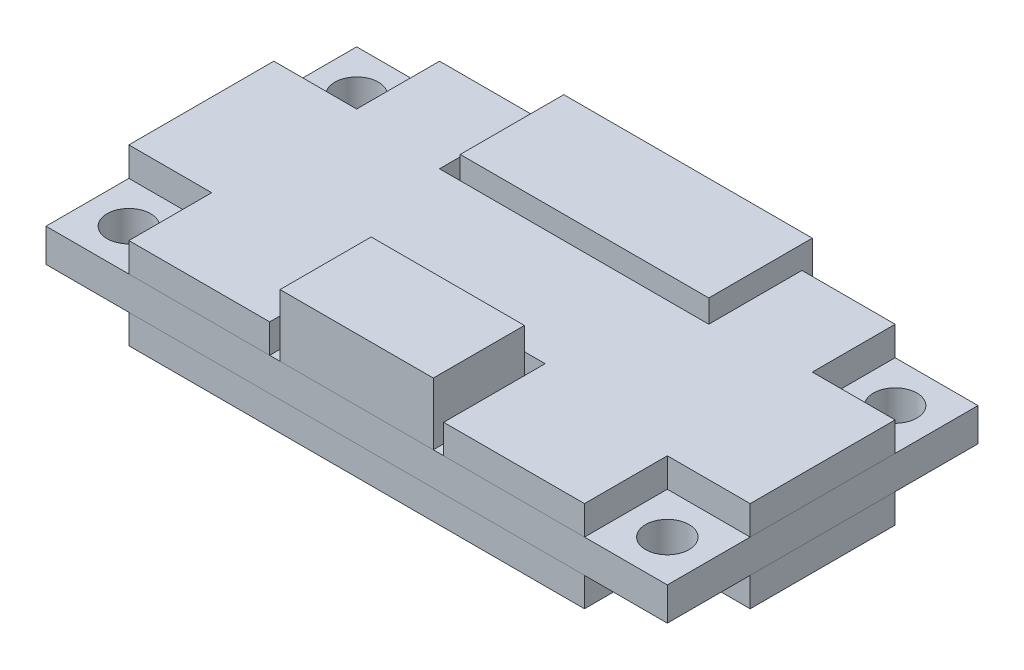
from build123d import *

# Parameters (mm, degrees)
SKETCH1_W           = 30
SKETCH1_H           = 15
SKETCH1_R           = 1.05
BOSS_EXTRUDE1_DEPTH = 1.6
SKETCH2_W           = 12
SKETCH2_H           = 5
BOSS_EXTRUDE2_DEPTH = 2
SKETCH3_W           = 7.4
SKETCH3_H           = 4.4
BOSS_EXTRUDE3_DEPTH = 3
BOSS_EXTRUDE4_DEPTH = 1.4
BOSS_EXTRUDE5_DEPTH = 1.4


with BuildPart() as part:
    # Sketch1 → Boss-Extrude1 (new body)
    with BuildSketch(Plane(origin=(0, 0, 0), x_dir=(1, 0, 0), z_dir=(0, 1, 0))):
        Rectangle(SKETCH1_W, SKETCH1_H)
        with Locations(Location((13, 5.5, 0), (0, 0, 270))):
            Circle(SKETCH1_R, mode=Mode.SUBTRACT)
        with Locations(Location((13, -5.5, 0), (0, 0, 270))):
            Circle(SKETCH1_R, mode=Mode.SUBTRACT)
        with Locations(Location((-13, -5.5, 0), (0, 0, 270))):
            Circle(SKETCH1_R, mode=Mode.SUBTRACT)
        with Locations(Location((-13, 5.5, 0), (0, 0, 270))):
            Circle(SKETCH1_R, mode=Mode.SUBTRACT)
    extrude(amount=-BOSS_EXTRUDE1_DEPTH)


with BuildPart() as body_2:
    # Sketch2 → Boss-Extrude2 (new body)
    with BuildSketch(Plane(origin=(0, 0, 0), x_dir=(1, 0, 0), z_dir=(0, 1, 0))):
        with Locations((0, 6)):
            Rectangle(SKETCH2_W, SKETCH2_H)
    extrude(amount=BOSS_EXTRUDE2_DEPTH)


with BuildPart() as body_3:
    # Sketch3 → Boss-Extrude3 (new body)
    with BuildSketch(Plane(origin=(0, 0, 0), x_dir=(1, 0, 0), z_dir=(0, 1, 0))):
        with Locations((0, -5.3)):
            Rectangle(SKETCH3_W, SKETCH3_H)
    extrude(amount=BOSS_EXTRUDE3_DEPTH)


with BuildPart() as body_4:
    # Sketch4 → Boss-Extrude4 (new body)
    with BuildSketch(Plane.XZ.offset(1.6)):
        Polygon((-15, 3.5), (-11, 3.5), (-11, 7.5), (11, 7.5), (11, 3.5), (15, 3.5), (15, -3.5), (11, -3.5), (11, -7.5), (-11, -7.5), (-11, -3.5), (-15, -3.5), align=None)
    extrude(amount=BOSS_EXTRUDE4_DEPTH)


with BuildPart() as body_5:
    # Sketch5 → Boss-Extrude5 (new body)
    with BuildSketch(Plane(origin=(0, 0, 0), x_dir=(1, 0, 0), z_dir=(0, 1, 0))):
        Polygon((-11, -3.5), (-11, -7.5), (-4.2, -7.5), (-4.2, -2.6), (4.2, -2.6), (4.2, -7.5), (11, -7.5), (11, -3.5), (15, -3.5), (15, 3.5), (11, 3.5), (11, 7.5), (6.5, 7.5), (6.5, 3), (-6.5, 3), (-6.5, 7.5), (-11, 7.5), (-11, 3.5), (-15, 3.5), (-15, -3.5), align=None)
    extrude(amount=BOSS_EXTRUDE5_DEPTH)


solid = Compound([part.part, body_2.part, body_3.part, body_4.part, body_5.part])
